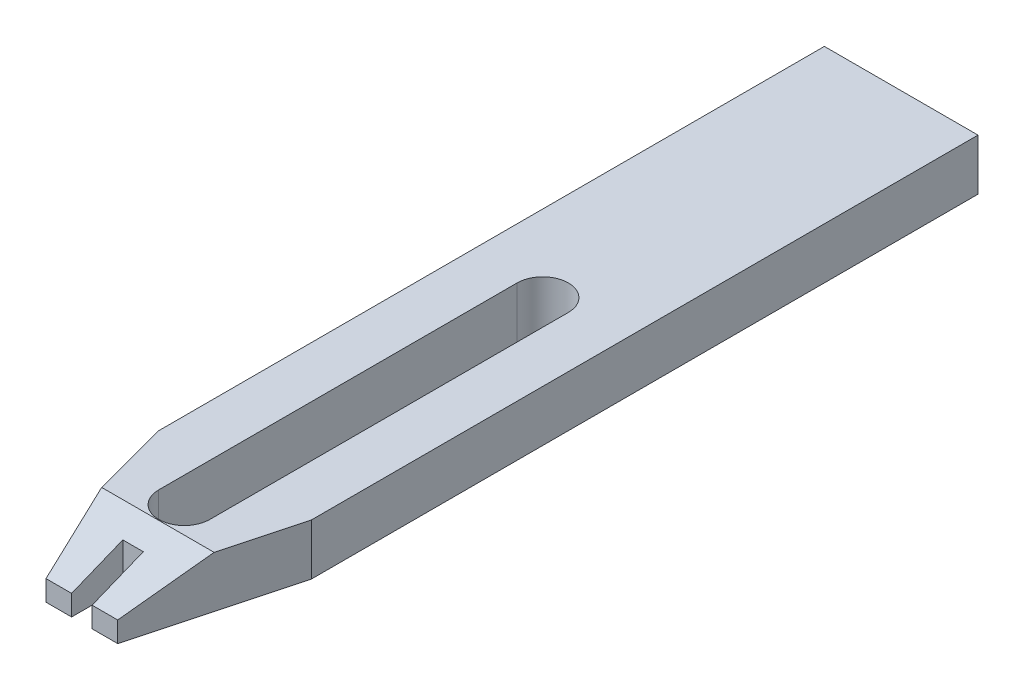
from build123d import *
from OCP.BRepFilletAPI import BRepFilletAPI_MakeChamfer

# Parameters (mm, degrees)
BOSS_EXTRUDE1_DEPTH = 5
CHAMFER1_SIZE       = 4
CHAMFER1_SIZE2      = 14.92820323
CHAMFER2_SIZE       = 3
CHAMFER2_SIZE2      = 7.42526056


with BuildPart() as part:
    # Sketch1 → Boss-Extrude1 (new body)
    with BuildSketch(Plane(origin=(0, 0, 0), x_dir=(1, 0, 0), z_dir=(0, 1, 0))):
        Polygon((-7.5, 40), (7.5, 40), (7.5, -40), (1, -40), (1, -35), (-1, -35), (-1, -40), (-7.5, -40), align=None)
        with BuildLine():
            Line((-2.5, -30), (-2.5, 5))
            ThreePointArc((-2.5, 5), (0, 7.5), (2.5, 5))
            Line((2.5, 5), (2.5, -30))
            ThreePointArc((2.5, -30), (0, -32.5), (-2.5, -30))
        make_face(mode=Mode.SUBTRACT)
    extrude(amount=BOSS_EXTRUDE1_DEPTH)

    # Chamfer1: one chamfer whose edges measure the first distance from different faces: ONE call of the kernel's chamfer builder (chamfer() names one face for all edges)
    chamfer1_edges_1 = [part.edges().sort_by_distance(p)[0] for p in [
        (-7.5, 2.5, 40),
    ]]
    chamfer1_side_1 = [part.faces().sort_by_distance(p)[0] for p in [
        (-4.25, 2.5, 40),
    ]]
    chamfer1_edges_2 = [part.edges().sort_by_distance(p)[0] for p in [
        (7.5, 2.5, 40),
    ]]
    chamfer1_side_2 = [part.faces().sort_by_distance(p)[0] for p in [
        (4.25, 2.5, 40),
    ]]
    chamfer1 = BRepFilletAPI_MakeChamfer(part.part.solid().wrapped)
    for e in chamfer1_edges_1:
        chamfer1.Add(CHAMFER1_SIZE, CHAMFER1_SIZE2, e.wrapped, chamfer1_side_1[0].wrapped)  # the first distance lies on this face
    for e in chamfer1_edges_2:
        chamfer1.Add(CHAMFER1_SIZE, CHAMFER1_SIZE2, e.wrapped, chamfer1_side_2[0].wrapped)  # the first distance lies on this face
    add(Compound.cast(chamfer1.Shape()), mode=Mode.REPLACE)

    # Chamfer2
    chamfer2_edges = [part.edges().sort_by_distance(p)[0] for p in [
        (2.25, 5, 40),
    ]]
    chamfer2_side = [part.faces().sort_by_distance(p)[0] for p in [
        (2.25, 2.5, 40),
    ]]
    chamfer(chamfer2_edges, length=CHAMFER2_SIZE, length2=CHAMFER2_SIZE2, reference=chamfer2_side[0])


solid = part.part
